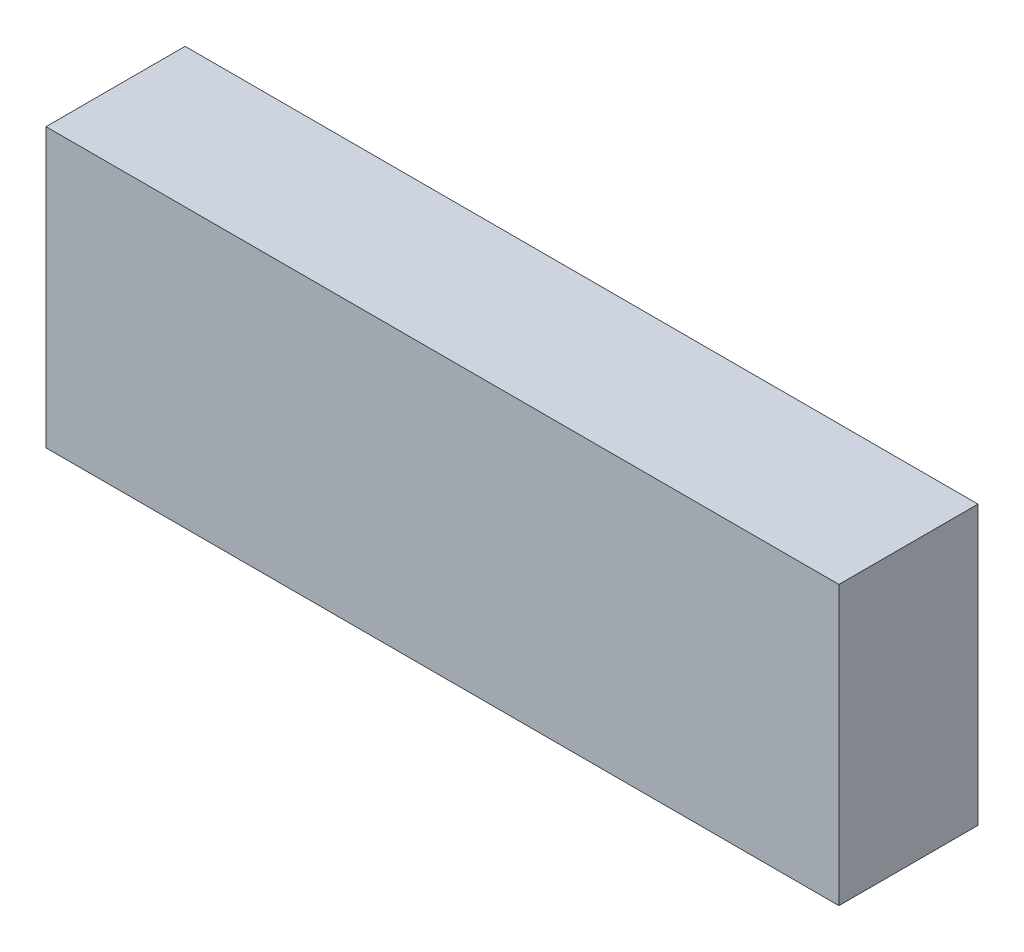
from build123d import *

# Parameters (mm, degrees)
SKETCH1_W           = 57
SKETCH1_H           = 20
BOSS_EXTRUDE1_DEPTH = 10


with BuildPart() as part:
    # Sketch1 → Boss-Extrude1 (new body)
    with BuildSketch(Plane.XY):
        with Locations((28.5, 10)):
            Rectangle(SKETCH1_W, SKETCH1_H)
    extrude(amount=BOSS_EXTRUDE1_DEPTH)


solid = part.part
